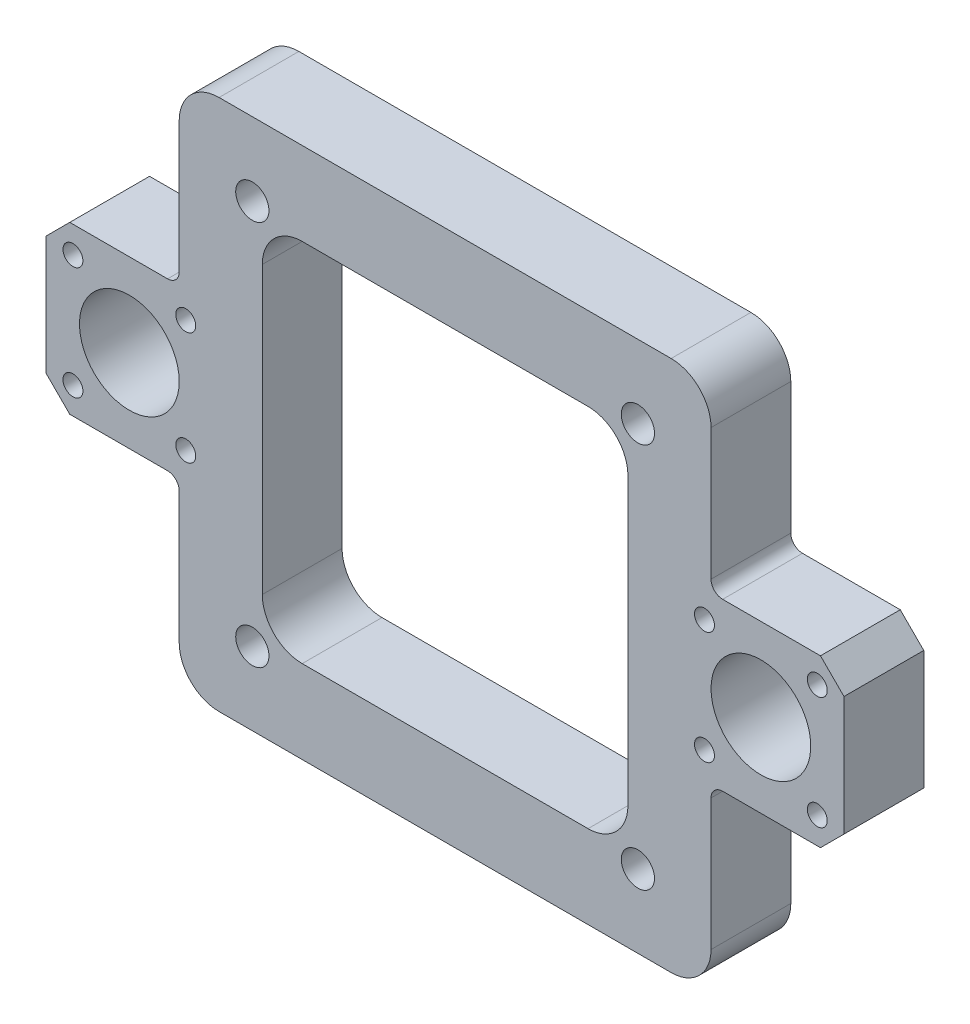
from build123d import *

# Parameters (mm, degrees)
SKETCH1_R               = 7.5
SKETCH1_R_2             = 1.5
SKETCH1_R_3             = 2.5
BOSS_EXTRUDE1_DEPTH     = 12
CUT_EXTRUDE1_DEPTH      = 74.10266753
CUT_EXTRUDE1_DEPTH_BACK = 74.10266753


with BuildPart() as part:
    # Sketch1 → Boss-Extrude1 (new body)
    with BuildSketch(Plane.XY):
        with BuildLine():
            Line((-56.464466094, 12.5), (-41.75, 12.5))
            ThreePointArc((-41.75, 12.5), (-40.512563133, 13.012563133), (-40, 14.25))
            Line((-40, 14.25), (-40, 34))
            ThreePointArc((-40, 34), (-38.242640687, 38.242640687), (-34, 40))
            Line((-34, 40), (34, 40))
            ThreePointArc((34, 40), (38.242640687, 38.242640687), (40, 34))
            Line((40, 34), (40, 14.25))
            ThreePointArc((40, 14.25), (40.512563133, 13.012563133), (41.75, 12.5))
            Line((41.75, 12.5), (56.464466094, 12.5))
            Line((56.464466094, 12.5), (60, 8.964466094))
            Line((60, 8.964466094), (60, -8.964466094))
            Line((60, -8.964466094), (56.464466094, -12.5))
            Line((56.464466094, -12.5), (41.75, -12.5))
            ThreePointArc((41.75, -12.5), (40.512563133, -13.012563133), (40, -14.25))
            Line((40, -14.25), (40, -34))
            ThreePointArc((40, -34), (38.242640687, -38.242640687), (34, -40))
            Line((34, -40), (-34, -40))
            ThreePointArc((-34, -40), (-38.242640687, -38.242640687), (-40, -34))
            Line((-40, -34), (-40, -14.25))
            ThreePointArc((-40, -14.25), (-40.512563133, -13.012563133), (-41.75, -12.5))
            Line((-41.75, -12.5), (-56.464466094, -12.5))
            Line((-56.464466094, -12.5), (-60, -8.964466094))
            Line((-60, -8.964466094), (-60, 8.964466094))
            Line((-60, 8.964466094), (-56.464466094, 12.5))
        make_face()
        with Locations((-47.5, 0)):
            Circle(SKETCH1_R, mode=Mode.SUBTRACT)
        with Locations(Location((47.5, 0, 0), (0, 0, 180))):
            Circle(SKETCH1_R, mode=Mode.SUBTRACT)
        with Locations((-55.985281374, 8.485281374)):
            Circle(SKETCH1_R_2, mode=Mode.SUBTRACT)
        with Locations((-39.014718626, -8.485281374)):
            Circle(SKETCH1_R_2, mode=Mode.SUBTRACT)
        with Locations((-39.014718626, 8.485281374)):
            Circle(SKETCH1_R_2, mode=Mode.SUBTRACT)
        with Locations((-55.985281374, -8.485281374)):
            Circle(SKETCH1_R_2, mode=Mode.SUBTRACT)
        with Locations(Location((39.014718626, -8.485281374, 0), (0, 0, 180))):
            Circle(SKETCH1_R_2, mode=Mode.SUBTRACT)
        with Locations(Location((55.985281374, -8.485281374, 0), (0, 0, 180))):
            Circle(SKETCH1_R_2, mode=Mode.SUBTRACT)
        with Locations(Location((55.985281374, 8.485281374, 0), (0, 0, 180))):
            Circle(SKETCH1_R_2, mode=Mode.SUBTRACT)
        with Locations(Location((39.014718626, 8.485281374, 0), (0, 0, 180))):
            Circle(SKETCH1_R_2, mode=Mode.SUBTRACT)
        with Locations((-29, 29)):
            Circle(SKETCH1_R_3, mode=Mode.SUBTRACT)
        with Locations(Location((29, 29, 0), (0, 0, 180))):
            Circle(SKETCH1_R_3, mode=Mode.SUBTRACT)
        with Locations((29, -29)):
            Circle(SKETCH1_R_3, mode=Mode.SUBTRACT)
        with Locations(Location((-29, -29, 0), (0, 0, 180))):
            Circle(SKETCH1_R_3, mode=Mode.SUBTRACT)
    extrude(amount=BOSS_EXTRUDE1_DEPTH)

    # Sketch2 → Cut-Extrude1 (cut, two sides: drawn at the far end of the back side and taken through both)
    with BuildSketch(Plane.XY.offset(12).offset(-CUT_EXTRUDE1_DEPTH_BACK)):
        with BuildLine():
            Line((-21.5, 27.5), (21.5, 27.5))
            ThreePointArc((21.5, 27.5), (25.742640687, 25.742640687), (27.5, 21.5))
            Line((27.5, 21.5), (27.5, -21.5))
            ThreePointArc((27.5, -21.5), (25.742640687, -25.742640687), (21.5, -27.5))
            Line((21.5, -27.5), (-21.5, -27.5))
            ThreePointArc((-21.5, -27.5), (-25.742640687, -25.742640687), (-27.5, -21.5))
            Line((-27.5, -21.5), (-27.5, 21.5))
            ThreePointArc((-27.5, 21.5), (-25.742640687, 25.742640687), (-21.5, 27.5))
        make_face()
    extrude(amount=CUT_EXTRUDE1_DEPTH + CUT_EXTRUDE1_DEPTH_BACK, mode=Mode.SUBTRACT)


solid = part.part
